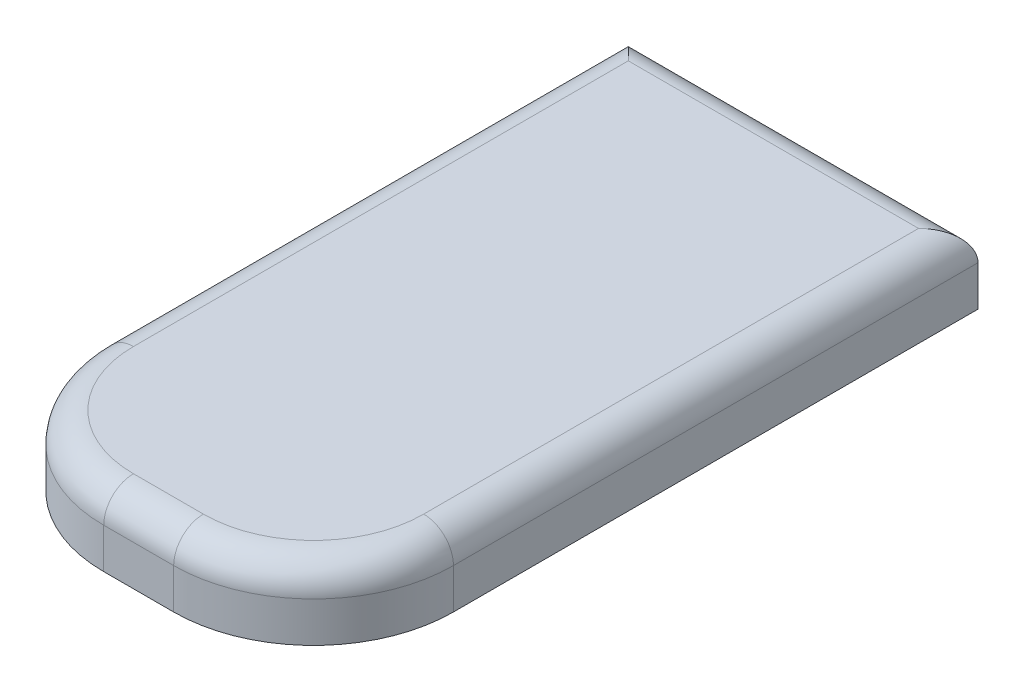
from build123d import *

# Parameters (mm, degrees)
SKETCH2_W           = 508
SKETCH2_H           = 101.6
BOSS_EXTRUDE2_DEPTH = 965.2
SKETCH3_R           = 25.4
SKETCH3_W           = 25.4
SKETCH3_H           = 25.4
CUT_EXTRUDE1_DEPTH  = 50.8
FILLET1_R           = 203.2
FILLET2_R           = 203.2
FILLET4_R           = 43.18


with BuildPart() as part:
    # Sketch2 → Boss-Extrude2 (new body)
    with BuildSketch(Plane.XY):
        with Locations((254, 50.8)):
            Rectangle(SKETCH2_W, SKETCH2_H)
    extrude(amount=BOSS_EXTRUDE2_DEPTH)

    # Sketch3 → Cut-Extrude1 (cut)
    with BuildSketch(Plane(origin=(0, 0, 0), x_dir=(-1, 0, 0), z_dir=(0, -1, 0))):
        with Locations(Location((-88.9, -736.6, 0), (0, 0, 90))):
            Circle(SKETCH3_R)
        with Locations(Location((-419.1, -736.6, 0), (0, 0, 90))):
            Circle(SKETCH3_R)
        with Locations((-393.7, -228.6)):
            Rectangle(SKETCH3_W, SKETCH3_H)
        with Locations((-114.3, -228.6)):
            Rectangle(SKETCH3_W, SKETCH3_H)
    extrude(amount=-CUT_EXTRUDE1_DEPTH, mode=Mode.SUBTRACT)

    # Fillet1
    fillet1_edges = [part.edges().sort_by_distance(p)[0] for p in [
        (0, 50.8, 965.2),
    ]]
    fillet(fillet1_edges, radius=FILLET1_R)

    # Fillet2
    fillet2_edges = [part.edges().sort_by_distance(p)[0] for p in [
        (508, 50.8, 965.2),
    ]]
    fillet(fillet2_edges, radius=FILLET2_R)

    # Fillet4
    fillet4_edges = [part.edges().sort_by_distance(p)[0] for p in [
        (254, 101.6, 965.2),
        (0, 101.6, 381),
        (59.515902063, 101.6, 905.684097937),
        (508, 101.6, 381),
        (254, 101.6, 0),
        (448.484097937, 101.6, 905.684097937),
    ]]
    fillet(fillet4_edges, radius=FILLET4_R)


solid = part.part
